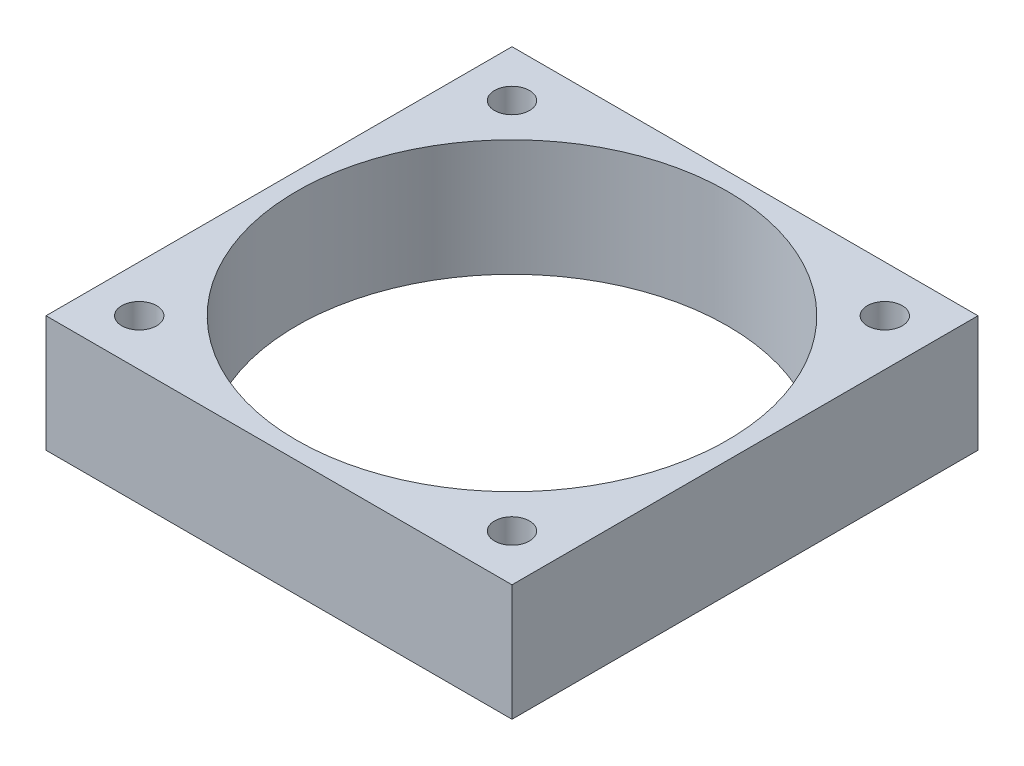
from build123d import *

# Parameters (mm, degrees)
SKETCH1_W           = 40
SKETCH1_H           = 40
BOSS_EXTRUDE1_DEPTH = 10
SKETCH2_R           = 1.5
CUT_EXTRUDE1_DEPTH  = 58.445626465
SKETCH3_R           = 18.5
CUT_EXTRUDE2_DEPTH  = 10


with BuildPart() as part:
    # Sketch1 → Boss-Extrude1 (new body)
    with BuildSketch(Plane(origin=(0, 0, 0), x_dir=(1, 0, 0), z_dir=(0, 1, 0))):
        with Locations((20, -20)):
            Rectangle(SKETCH1_W, SKETCH1_H)
    extrude(amount=BOSS_EXTRUDE1_DEPTH)

    # Sketch2 → Cut-Extrude1 (cut, through all)
    with BuildSketch(Plane(origin=(0, 10, 0), x_dir=(1, 0, 0), z_dir=(0, 1, 0))):
        with Locations(Location((4, -36, 0), (0, 0, 270))):
            Circle(SKETCH2_R)
        with Locations(Location((36, -36, 0), (0, 0, 270))):
            Circle(SKETCH2_R)
        with Locations(Location((36, -4, 0), (0, 0, 270))):
            Circle(SKETCH2_R)
        with Locations(Location((4, -4, 0), (0, 0, 270))):
            Circle(SKETCH2_R)
    extrude(amount=-CUT_EXTRUDE1_DEPTH, mode=Mode.SUBTRACT)

    # Sketch3 → Cut-Extrude2 (cut)
    with BuildSketch(Plane(origin=(0, 10, 0), x_dir=(1, 0, 0), z_dir=(0, 1, 0))):
        with Locations(Location((20, -20, 0), (0, 0, 270))):
            Circle(SKETCH3_R)
    extrude(amount=-CUT_EXTRUDE2_DEPTH, mode=Mode.SUBTRACT)


solid = part.part
